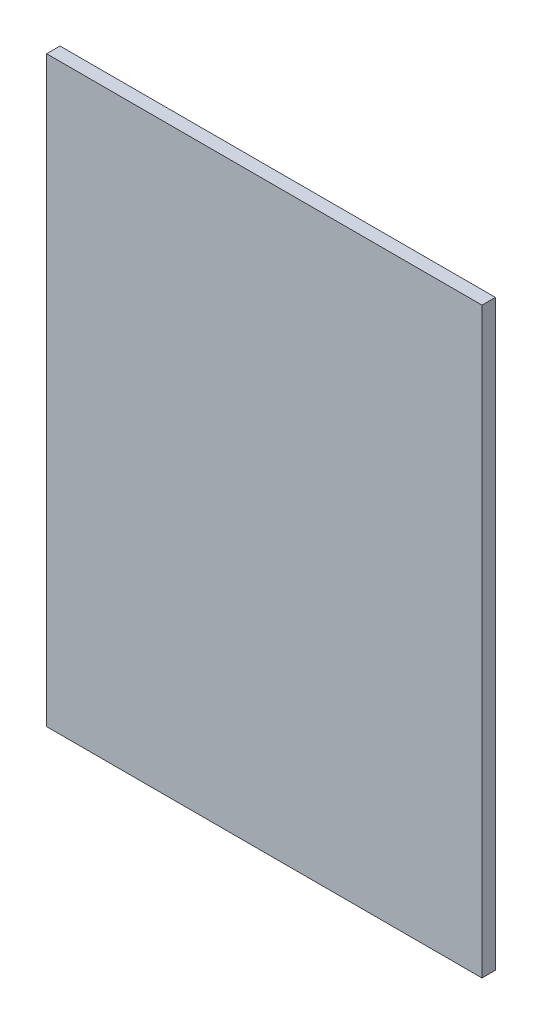
from build123d import *

# Parameters (mm, degrees)
SKETCH_1_W      = 65
SKETCH_1_H      = 87
EXTRUDE_1_DEPTH = 2


with BuildPart() as part:
    # Эскиз1 → Бобышка-Вытянуть1 (new body)
    with BuildSketch(Plane.XY):
        Rectangle(SKETCH_1_W, SKETCH_1_H)
    extrude(amount=EXTRUDE_1_DEPTH)


solid = part.part
